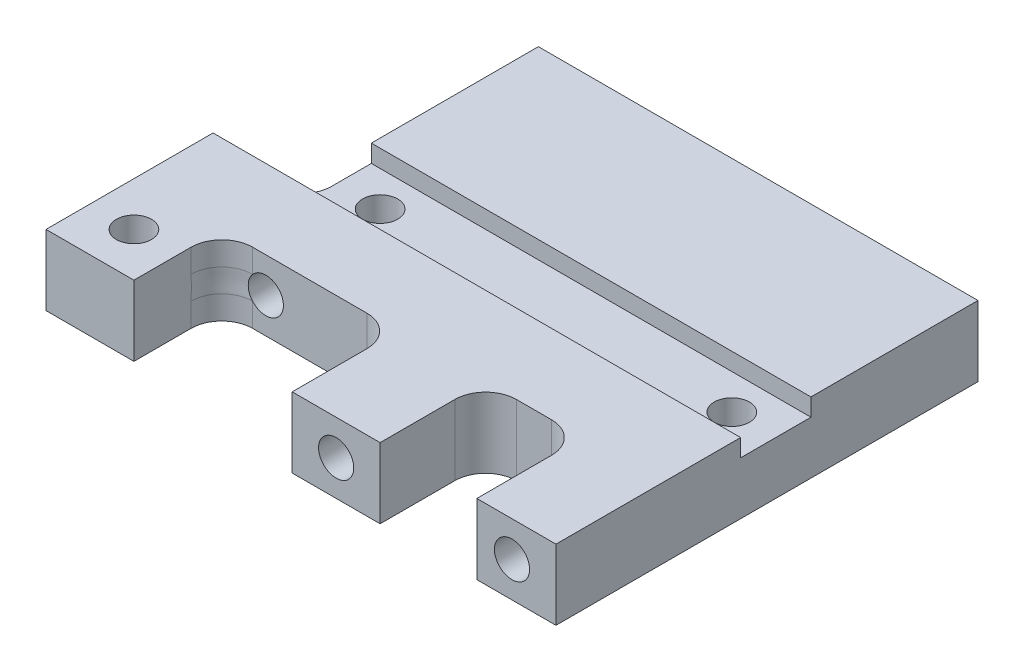
from build123d import *

# Parameters (mm, degrees)
BOSS_EXTRU_1_DEPTH      = 8
ESQUISSE2_R             = 2
ENL_V_MAT_EXTRU_1_DEPTH = 15
ENL_V_START             = -10
ESQUISSE3_R             = 2
ENL_V_MAT_EXTRU_2_DEPTH = 10
ESQUISSE4_R             = 2
ENL_V_MAT_EXTRU_3_DEPTH = 10
CHANFREIN1_SIZE         = 2.5
ESQUISSE5_W             = 50
ESQUISSE5_H             = 8
ENL_V_MAT_EXTRU_4_DEPTH = 2
ESQUISSE6_W             = 19
ESQUISSE6_H             = 8
BOSS_EXTRU_2_DEPTH      = 10
CONG_1_R                = 3.5
ESQUISSE7_R             = 2
ENL_V_MAT_EXTRU_5_DEPTH = 82.808975418


with BuildPart() as part:
    # Esquisse1 → Boss.-Extru.1 (new body)
    with BuildSketch(Plane(origin=(0, 0, 0), x_dir=(1, 0, 0), z_dir=(0, 1, 0))):
        Polygon((-57.148145082, 46.041666667), (-7.148145082, 46.041666667), (-7.148145082, 16.041666667), (-7.148145082, -1.958333333), (-16.148145082, -1.958333333), (-16.148145082, 10.041666667), (-27.148145082, 10.041666667), (-27.148145082, -1.958333333), (-37.148145082, -1.958333333), (-37.148145082, 10.041666667), (-48.148145082, 10.041666667), (-57.148145082, 10.041666667), align=None)
    extrude(amount=BOSS_EXTRU_1_DEPTH)

    # Esquisse2 → Enlèv. mat.-Extru.1 (cut)
    with BuildSketch(Plane.XY.offset(1.958333333)):
        with Locations((-52.148145082, 4)):
            Circle(ESQUISSE2_R)
        with Locations((-12.148145082, 4)):
            Circle(ESQUISSE2_R)
        with Locations((-32.148145082, 4)):
            Circle(ESQUISSE2_R)
    extrude(amount=-ENL_V_MAT_EXTRU_1_DEPTH, mode=Mode.SUBTRACT)

    # Esquisse3 → Enlèv. mat.-Extru.2 (cut)
    with BuildSketch(Plane(origin=(0, 0, -46.041666667), x_dir=(-1, 0, 0), z_dir=(0, 0, -1)).offset(ENL_V_START)):
        with Locations(Location((12.148145082, 4, 0), (0, 0, 180))):
            Circle(ESQUISSE3_R)
        with Locations(Location((52.148145082, 4, 0), (0, 0, 180))):
            Circle(ESQUISSE3_R)
    extrude(amount=ENL_V_MAT_EXTRU_2_DEPTH, mode=Mode.SUBTRACT)

    # Esquisse4 → Enlèv. mat.-Extru.3 (cut)
    with BuildSketch(Plane(origin=(0, 8, 0), x_dir=(1, 0, 0), z_dir=(0, 1, 0))):
        with Locations(Location((-52.148145082, 23.041666667, 0), (0, 0, 270))):
            Circle(ESQUISSE4_R)
        with Locations(Location((-12.148145082, 23.041666667, 0), (0, 0, 270))):
            Circle(ESQUISSE4_R)
    extrude(amount=-ENL_V_MAT_EXTRU_3_DEPTH, mode=Mode.SUBTRACT)

    # Chanfrein1
    chanfrein1_edges = [part.edges().sort_by_distance(p)[0] for p in [
        (-52.148145082, 0, -25.041666667),
        (-12.148145082, 0, -25.041666667),
    ]]
    chamfer(chanfrein1_edges, length=CHANFREIN1_SIZE)

    # Esquisse5 → Enlèv. mat.-Extru.4 (cut)
    with BuildSketch(Plane(origin=(0, 8, 0), x_dir=(1, 0, 0), z_dir=(0, 1, 0))):
        with Locations((-32.148145082, 23.041666667)):
            Rectangle(ESQUISSE5_W, ESQUISSE5_H)
    extrude(amount=-ENL_V_MAT_EXTRU_4_DEPTH, mode=Mode.SUBTRACT)

    # Esquisse6 → Boss.-Extru.2 (add)
    with BuildSketch(Plane.ZY.offset(57.148145082)):
        with Locations((-9.541666667, 4)):
            Rectangle(ESQUISSE6_W, ESQUISSE6_H)
    extrude(amount=BOSS_EXTRU_2_DEPTH)

    # Congé1
    cong_1_edges = [part.edges().sort_by_distance(p)[0] for p in [
        (-16.148145082, 4, -10.041666667),
        (-27.148145082, 4, -10.041666667),
        (-37.148145082, 4, -10.041666667),
        (-57.148145082, 4, -10.041666667),
        (-57.148145082, 3, -19.041666667),
    ]]
    fillet(cong_1_edges, radius=CONG_1_R)

    # Esquisse7 → Enlèv. mat.-Extru.5 (cut, through all)
    with BuildSketch(Plane(origin=(0, 8, 0), x_dir=(1, 0, 0), z_dir=(0, 1, 0))):
        with Locations(Location((-62.148145082, 5.041666667, 0), (0, 0, 270))):
            Circle(ESQUISSE7_R)
    extrude(amount=-ENL_V_MAT_EXTRU_5_DEPTH, mode=Mode.SUBTRACT)


solid = part.part
